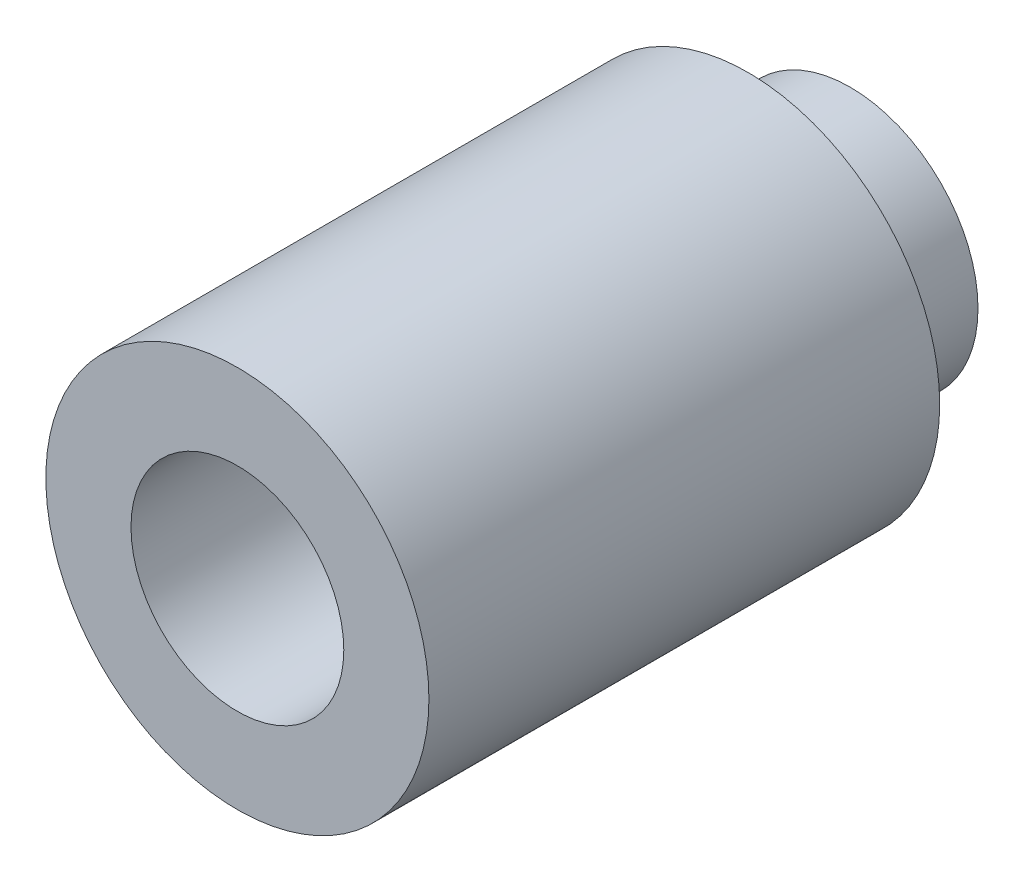
from build123d import *
from build123d.topology import SkipClean

# Parameters (mm, degrees)
SKETCH_1_R      = 2.25
SKETCH_1_R_2    = 1.25
EXTRUDE_1_DEPTH = 6
EXTRUDE_START   = 1.2
SKETCH_2_R      = 1.5
SKETCH_2_R_2    = 1.25
EXTRUDE_2_DEPTH = 1.2


with BuildPart() as part:
    # 草图1 → 凸台-拉伸1 (new body)
    with BuildSketch(Plane.XY):
        Circle(SKETCH_1_R)
        Circle(SKETCH_1_R_2, mode=Mode.SUBTRACT)
    extrude(amount=EXTRUDE_1_DEPTH)

    # 草图2 → 凸台-拉伸2 (add)
    with SkipClean():  # the faces are left unmerged after this step: merging them gives an invalid solid
        with BuildSketch(Plane(origin=(0, 0, 0), x_dir=(-1, 0, 0), z_dir=(0, 0, -1)).offset(EXTRUDE_START)):
            with Locations(Location((0, 0, 0), (0, 0, 180))):
                Circle(SKETCH_2_R)
            Circle(SKETCH_2_R_2, mode=Mode.SUBTRACT)
        extrude(amount=-EXTRUDE_2_DEPTH)


solid = part.part
